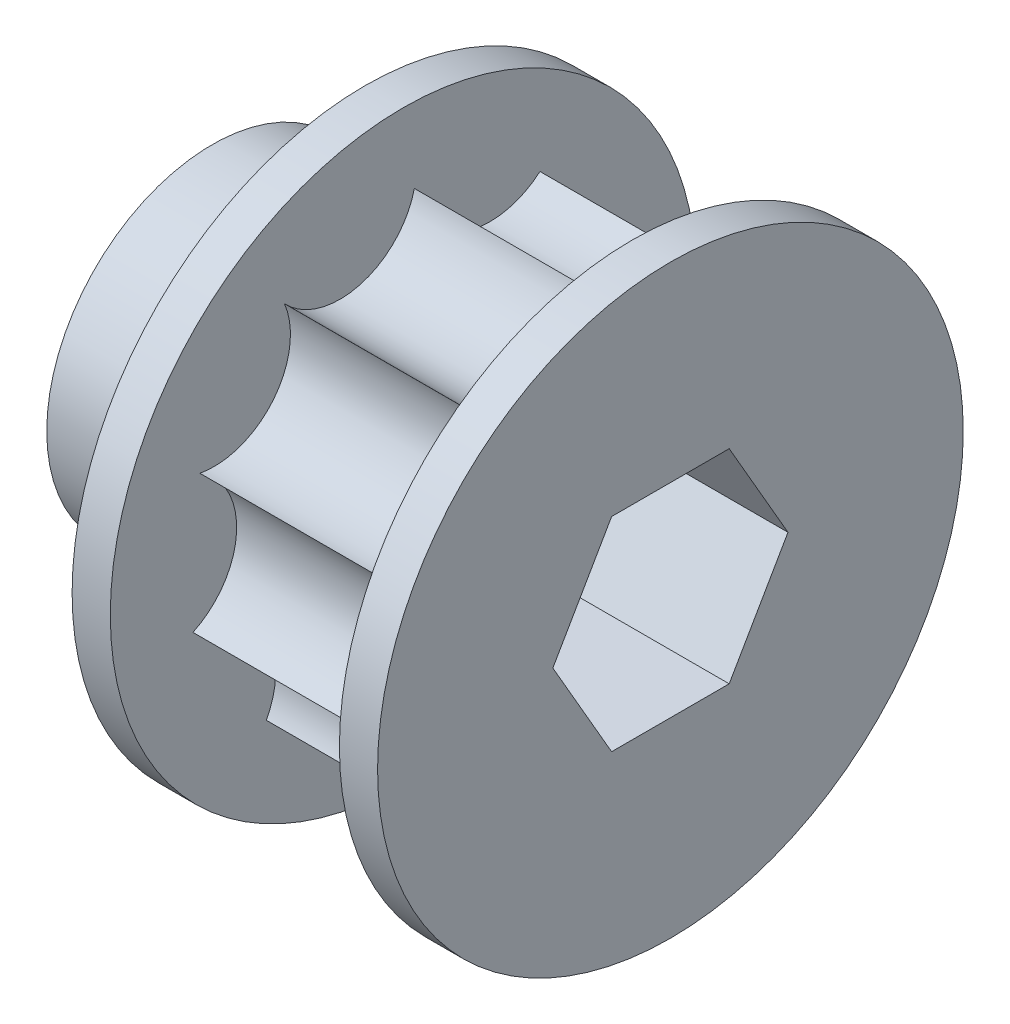
from build123d import *

# Parameters (mm, degrees)
SKETCH1_R           = 10.31875
BOSS_EXTRUDE1_DEPTH = 9.525
SKETCH2_R           = 18.2626
BOSS_EXTRUDE2_DEPTH = 19.05
CUT_EXTRUDE1_START  = -2.38125
SKETCH3_OUTSIDE_W   = 50.332
SKETCH3_OUTSIDE_H   = 50.332
SKETCH3_OUTSIDE_R   = 15.1638
CUT_EXTRUDE1_DEPTH  = 14.2875
CUT_EXTRUDE2_DEPTH  = 14.2875
CIRPATTERN1_COUNT   = 10
CUT_EXTRUDE3_DEPTH  = 39.517213587


with BuildPart() as part:
    # Sketch1 → Boss-Extrude1 (new body)
    with BuildSketch(Plane(origin=(0, 0, 0), x_dir=(0, 0, -1), z_dir=(1, 0, 0))):
        Circle(SKETCH1_R)
    extrude(amount=BOSS_EXTRUDE1_DEPTH)

    # Sketch2 → Boss-Extrude2 (add)
    with BuildSketch(Plane(origin=(9.525, 0, 0), x_dir=(0, 0, -1), z_dir=(1, 0, 0))):
        Circle(SKETCH2_R)
    extrude(amount=BOSS_EXTRUDE2_DEPTH)

    # Sketch3 outside → Cut-Extrude1 (cut)
    with BuildSketch(Plane(origin=(28.575, 0, 0), x_dir=(0, 0, -1), z_dir=(1, 0, 0)).offset(CUT_EXTRUDE1_START)):
        Rectangle(SKETCH3_OUTSIDE_W, SKETCH3_OUTSIDE_H)
        Circle(SKETCH3_OUTSIDE_R, mode=Mode.SUBTRACT)
    extrude(amount=-CUT_EXTRUDE1_DEPTH, mode=Mode.SUBTRACT)

    # Sketch4 → Cut-Extrude2 (cut)
    with BuildSketch(Plane.ZY.offset(-26.19375)):
        with BuildLine():
            ThreePointArc((-7.949596792, 8.267008262), (-8.360122852, 10.201363213), (-9.520926588, 11.80223654))
            ThreePointArc((-9.520926588, 11.80223654), (-12.712096792, 8.267008262), (-14.649343405, 3.916320752))
            ThreePointArc((-14.649343405, 3.916320752), (-10.11832837, 4.272790989), (-7.949596792, 8.267008262))
        make_face()
    cut_extrude2 = extrude(amount=CUT_EXTRUDE2_DEPTH, mode=Mode.SUBTRACT)

    # CirPattern1: Cut-Extrude2 ×10 about axis
    cirpattern1_axis = Axis((9.525, 0, 0), (-1, 0, 0))
    for i in range(1, CIRPATTERN1_COUNT):
        add(cut_extrude2.rotate(cirpattern1_axis, i * 360 / CIRPATTERN1_COUNT), mode=Mode.SUBTRACT)

    # Sketch5 → Cut-Extrude3 (cut, through all)
    with BuildSketch(Plane.ZY):
        Polygon((-7.332348419, 0), (-3.666174209, -6.35), (3.666174209, -6.35), (7.332348419, 0), (3.666174209, 6.35), (-3.666174209, 6.35), align=None)
    extrude(amount=-CUT_EXTRUDE3_DEPTH, mode=Mode.SUBTRACT)


solid = part.part
